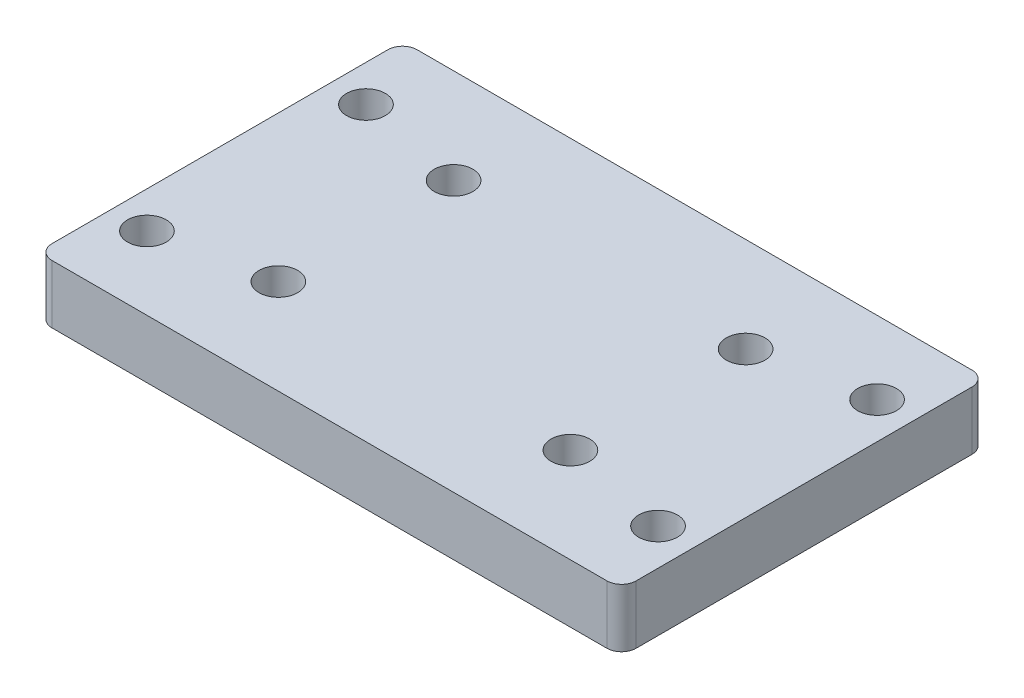
from build123d import *

# Parameters (mm, degrees)
SKETCH1_W                = 80
SKETCH1_H                = 50
BOSS_EXTRUDE1_DEPTH      = 8
FILLET1_R                = 2
M5_CLEARANCE_HOLE1_D     = 5.3
M5_CLEARANCE_HOLE1_DEPTH = 8
M5_CLEARANCE_HOLE1_TIP   = 1.59228064


with BuildPart() as part:
    # Sketch1 → Boss-Extrude1 (new body)
    with BuildSketch(Plane(origin=(0, 0, 0), x_dir=(1, 0, 0), z_dir=(0, 1, 0))):
        Rectangle(SKETCH1_W, SKETCH1_H)
    extrude(amount=BOSS_EXTRUDE1_DEPTH)

    # Fillet1
    fillet1_edges = [part.edges().sort_by_distance(p)[0] for p in [
        (-40, 4, -25),
        (40, 4, -25),
        (40, 4, 25),
        (-40, 4, 25),
    ]]
    fillet(fillet1_edges, radius=FILLET1_R)

    # M5 Clearance Hole1
    with Locations(Plane(origin=(0, 8, 0), x_dir=(1, 0, 0), z_dir=(0, 1, 0))):
        with Locations((-35, 15), (-20, 12), (-20, -12), (-35, -15), (35, -15), (20, -12), (20, 12), (35, 15)):
            Hole(M5_CLEARANCE_HOLE1_D / 2, depth=M5_CLEARANCE_HOLE1_DEPTH)
            with Locations((0, 0, -(M5_CLEARANCE_HOLE1_DEPTH + M5_CLEARANCE_HOLE1_TIP / 2))):  # 118° drill point
                Cone(0, M5_CLEARANCE_HOLE1_D / 2, M5_CLEARANCE_HOLE1_TIP, mode=Mode.SUBTRACT)


solid = part.part
